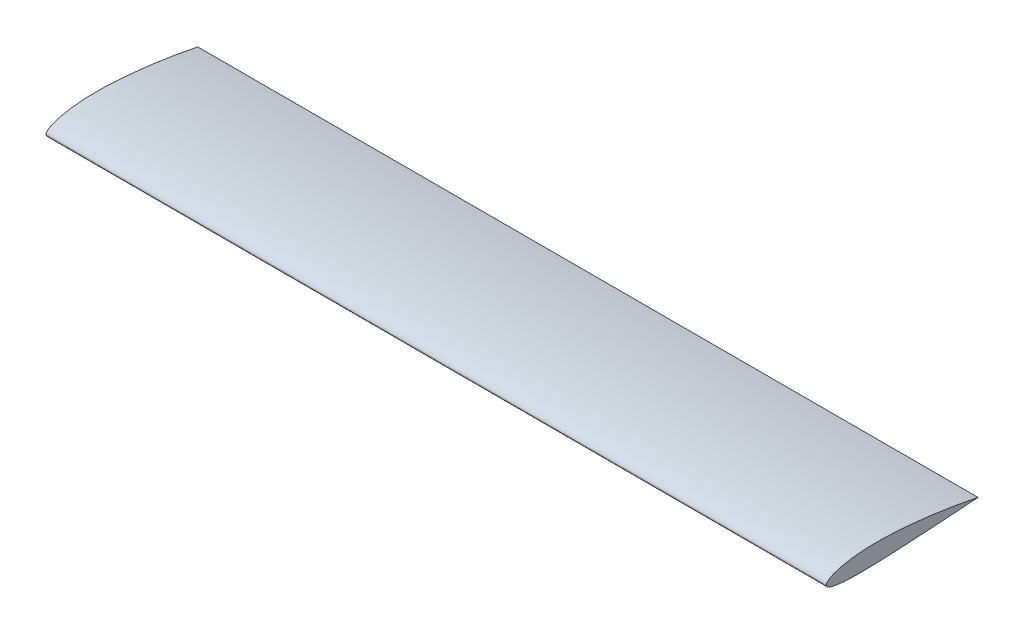
from build123d import *

# Parameters (mm, degrees)
BOSS_EXTRUDE1_DEPTH = 914.4


with BuildPart() as part:
    # Sketch1 → Boss-Extrude1 (new, symmetric)
    with BuildSketch(Plane(origin=(0, 0, 0), x_dir=(0, 0, -1), z_dir=(1, 0, 0))):
        with BuildLine():
            Line((355.701604223, -0.088925393), (355.701595777, 0.088925393))
            add(Edge.make_bspline(
                [(355.701595777, 0.088925393), (353.820982462, 0.484624006), (350.06290549, 1.275358513), (344.419734734, 2.408962112), (338.780435345, 3.513247784), (333.145393936, 4.589096783), (327.516243033, 5.641043921), (321.894278266, 6.670763349), (314.418943593, 8.013674063), (303.256989977, 9.961267985), (290.277200014, 12.110817322), (277.368997406, 14.122782619), (266.403335808, 15.743647964), (251.979265272, 17.758516876), (237.688697541, 19.583832213), (223.548423889, 21.227266214), (213.140838664, 22.358833154), (202.876901814, 23.397460327), (192.766904588, 24.342173051), (182.820991555, 25.190353241), (173.049135462, 25.938047), (161.921753844, 26.683596612), (149.534416125, 27.353932113), (135.989652303, 27.848354309), (122.941979988, 28.067908606), (110.421097294, 28.008634515), (99.700685712, 27.70889992), (90.693877117, 27.270082026), (83.303787262, 26.783507837), (76.187941197, 26.188565695), (69.353508496, 25.490932732), (62.807364716, 24.696725532), (56.55607045, 23.812359134), (50.605888599, 22.844435764), (44.962795376, 21.799726189), (39.63243323, 20.685186914), (35.394707795, 19.689903187), (31.419816929, 18.671677759), (28.402149112, 17.833197526), (25.50144884, 16.95559388), (23.445378481, 16.298147069), (21.472913476, 15.631380602), (19.584546687, 14.956184714), (17.780743367, 14.273442865), (16.06195061, 13.584002757), (14.428587512, 12.888691943), (12.881049825, 12.188303379), (11.419716074, 11.48357323), (10.044925338, 10.775218186), (8.757012698, 10.063858621), (7.556265732, 9.350096557), (6.442960183, 8.634442853), (5.41734041, 7.917341178), (4.479625436, 7.199163578), (3.630013343, 6.480194944), (2.868683951, 5.760637101), (2.195817362, 5.040591218), (1.611593819, 4.320078981), (1.116240148, 3.599032811), (0.710028115, 2.877331189), (0.393383634, 2.154853206), (0.166551826, 1.431555312), (0.030746426, 0.707533426), (-0.015114127, 0.002329992), (0.030112313, -0.683410252), (0.166804928, -1.347344433), (0.393412574, -2.006295978), (0.710184903, -2.658062956), (1.116500237, -3.300705173), (1.612044081, -3.932488358), (2.196514156, -4.551841216), (2.869673268, -5.157346551), (3.631321746, -5.747713809), (4.48127028, -6.321794728), (5.419326357, -6.878582731), (6.445281459, -7.417236784), (7.558905398, -7.937077043), (8.75995273, -8.437572313), (10.048142818, -8.918365838), (11.423181165, -9.379223403), (12.884736801, -9.820083947), (14.432465067, -10.24097372), (16.065990505, -10.642048548), (17.784917325, -11.023539859), (19.588825358, -11.385755651), (21.477272814, -11.729040657), (23.449794725, -12.053770385), (25.505901177, -12.360348541), (27.645083136, -12.649154466), (29.866809012, -12.920554156), (32.170526122, -13.174884958), (35.40298412, -13.496826381), (39.644839353, -13.855084832), (44.974526509, -14.213993504), (50.616889626, -14.509045711), (56.566312281, -14.740259074), (62.816831227, -14.907473033), (69.362181334, -15.010710112), (76.195788328, -15.050593096), (83.310763448, -15.028626298), (90.699932796, -14.947401655), (98.35585422, -14.810550775), (106.270843081, -14.622535012), (114.43694834, -14.388267984), (122.84596232, -14.11261942), (131.48943958, -13.799831736), (140.358695434, -13.453081911), (149.444813069, -13.074071891), (161.9675012, -12.520082041), (174.747578342, -11.904559712), (187.771766741, -11.220313883), (197.800794716, -10.662647689), (207.988754119, -10.065221608), (220.088376157, -9.321870273), (232.34561909, -8.533010587), (244.74861751, -7.71491707), (255.52281148, -6.998931225), (264.56639187, -6.399340387), (273.687256465, -5.797864129), (282.87625139, -5.19512005), (293.955974154, -4.468778712), (303.229665612, -3.851990276), (310.67667364, -3.344063333), (316.280044555, -2.953881085), (321.893308293, -2.553812497), (327.515028548, -2.14364169), (333.143759918, -1.724760729), (338.778048969, -1.300280395), (344.416501855, -0.877833024), (350.057427869, -0.463361084), (353.820268309, -0.213733561), (355.701604223, -0.088925393)],
                knots=[0, 0, 0, 0, 0.007940543, 0.015867786, 0.023782336, 0.031683842, 0.039571466, 0.047443805, 0.055299407, 0.070952907, 0.094259966, 0.109659749, 0.124931368, 0.140060475, 0.169836167, 0.184455938, 0.198878988, 0.213091981, 0.227081364, 0.240833733, 0.254335896, 0.267574898, 0.286913018, 0.305591757, 0.323574751, 0.340828862, 0.357323531, 0.367884026, 0.378086462, 0.387923234, 0.397387015, 0.406470797, 0.41516795, 0.423472244, 0.43137777, 0.438879022, 0.445971139, 0.449362331, 0.455832514, 0.458910652, 0.461883669, 0.464751272, 0.467513247, 0.470169459, 0.472719872, 0.475164567, 0.477503762, 0.479737826, 0.481867333, 0.483893084, 0.485816152, 0.487637951, 0.489360303, 0.49098553, 0.492516542, 0.493957004, 0.495311466, 0.496585561, 0.4977862, 0.498921787, 0.500002352, 0.50103964, 0.502046987, 0.503038995, 0.503951731, 0.504878158, 0.505831393, 0.506823576, 0.507865603, 0.508967032, 0.510136107, 0.511379885, 0.512704371, 0.51411466, 0.515615093, 0.517209348, 0.518900571, 0.520691419, 0.522584144, 0.524580638, 0.526682478, 0.528890964, 0.531207133, 0.533631806, 0.536165599, 0.538808937, 0.541562081, 0.544425147, 0.547398108, 0.550480817, 0.553673027, 0.556974385, 0.563902733, 0.571261381, 0.579045037, 0.58724742, 0.595861595, 0.604880098, 0.614294871, 0.624097261, 0.634278056, 0.644827522, 0.655735355, 0.666990799, 0.678582536, 0.690498843, 0.702727789, 0.715257042, 0.728074047, 0.754520377, 0.768123571, 0.781962351, 0.796022904, 0.810291085, 0.832050541, 0.846772874, 0.861649926, 0.876666219, 0.884221743, 0.899417941, 0.914715475, 0.9300999, 0.937820202, 0.945556969, 0.953308312, 0.961072259, 0.968846879, 0.976629764, 0.984418334, 0.992209516, 1, 1, 1, 1], degree=3))
        make_face()
    extrude(amount=BOSS_EXTRUDE1_DEPTH, both=True)


solid = part.part
